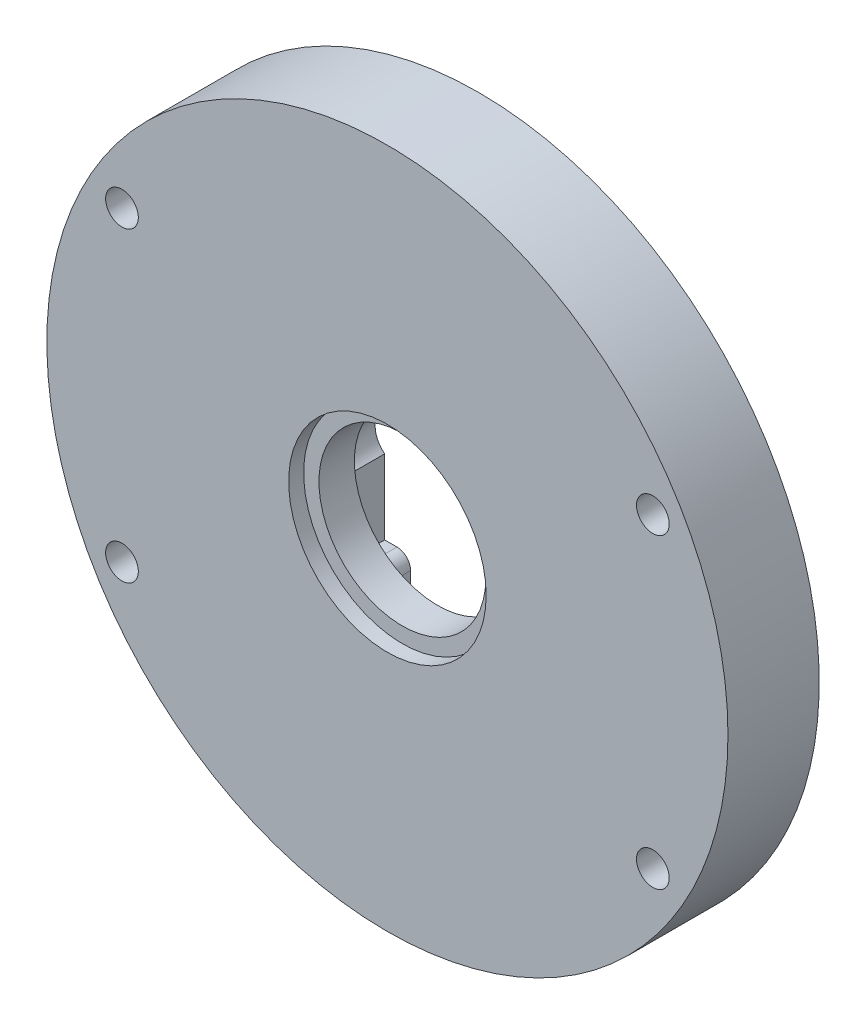
from build123d import *

# Parameters (mm, degrees)
EXTRUDE_1_DEPTH     = 3
CUT_EXTRUDE_4_DEPTH = 36.482389998
SKETCH_12_R         = 25
SKETCH_12_R_2       = 6.125
EXTRUDE_2_DEPTH     = 2.6
SKETCH_13_R         = 25
SKETCH_13_R_2       = 7.25
EXTRUDE_3_DEPTH     = 1.1
SKETCH_14_R         = 1.2
CUT_EXTRUDE_5_DEPTH = 36.984580031
FILLET_1_R          = 1


with BuildPart() as part:
    # 스케치1 → 보스-돌출1 (new body)
    with BuildSketch(Plane.XY):
        with BuildLine():
            Line((-5, -6.9), (-6.9, -6.9))
            Line((-6.9, -6.9), (-6.9, 6.9))
            Line((-6.9, 6.9), (6.9, 6.9))
            Line((6.9, 6.9), (6.9, -6.9))
            Line((6.9, -6.9), (5, -6.9))
            Line((5, -6.9), (5, -24.494897428))
            ThreePointArc((5, -24.494897428), (0, 25), (-5, -24.494897428))
            Line((-5, -24.494897428), (-5, -6.9))
        make_face()
    extrude(amount=EXTRUDE_1_DEPTH)

    # 스케치11 → 컷-돌출4 (cut, through all)
    with BuildSketch(Plane.XY.offset(3)):
        with BuildLine():
            Line((5.8, -1.8), (-5.8, -1.8))
            ThreePointArc((-5.8, -1.8), (-7.6, 0), (-5.8, 1.8))
            Line((-5.8, 1.8), (5.8, 1.8))
            ThreePointArc((5.8, 1.8), (7.6, 0), (5.8, -1.8))
        make_face()
    extrude(amount=-CUT_EXTRUDE_4_DEPTH, mode=Mode.SUBTRACT)

    # 스케치12 → 보스-돌출2 (add)
    with BuildSketch(Plane.XY.offset(3)):
        with Locations(Location((0, 0, 0), (0, 0, 258.463040967))):
            Circle(SKETCH_12_R)
        Circle(SKETCH_12_R_2, mode=Mode.SUBTRACT)
    extrude(amount=EXTRUDE_2_DEPTH)

    # 스케치13 → 보스-돌출3 (add)
    with BuildSketch(Plane.XY.offset(5.6)):
        with Locations(Location((0, 0, 0), (0, 0, 258.463040967))):
            Circle(SKETCH_13_R)
        Circle(SKETCH_13_R_2, mode=Mode.SUBTRACT)
    extrude(amount=EXTRUDE_3_DEPTH)

    # 스케치14 → 컷-돌출5 (cut, through all)
    with BuildSketch(Plane.XY.offset(6.7)):
        with Locations((19.485571585, -11.25)):
            Circle(SKETCH_14_R)
        with Locations((19.485571585, 11.25)):
            Circle(SKETCH_14_R)
        with Locations(Location((-19.485571585, 11.25, 0), (0, 0, 180))):
            Circle(SKETCH_14_R)
        with Locations(Location((-19.485571585, -11.25, 0), (0, 0, 180))):
            Circle(SKETCH_14_R)
    extrude(amount=-CUT_EXTRUDE_5_DEPTH, mode=Mode.SUBTRACT)

    # 필렛1
    fillet_1_edges = [part.edges().sort_by_distance(p)[0] for p in [
        (-5, -6.9, 1.5),
        (5, -6.9, 1.5),
    ]]
    fillet(fillet_1_edges, radius=FILLET_1_R)


solid = part.part
